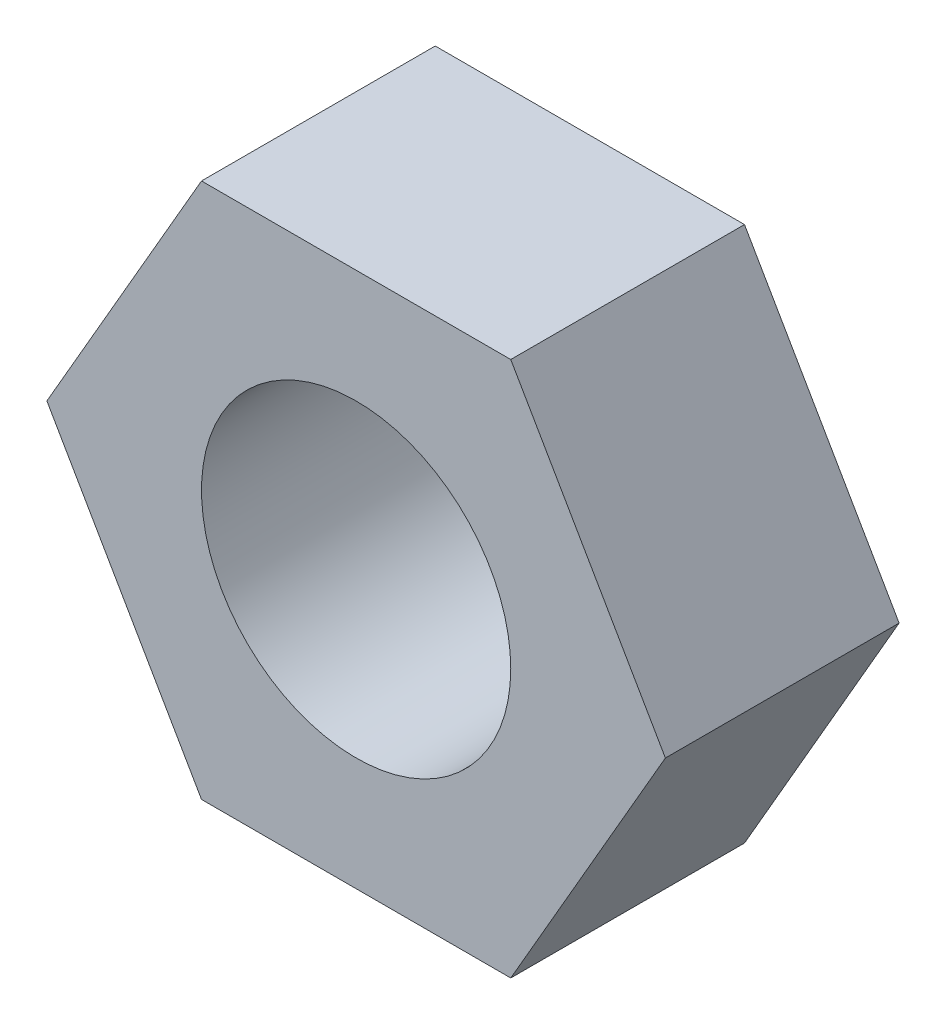
from build123d import *

# Parameters (mm, degrees)
SKETCH_1_R               = 1.58771324
EXTRUDE_M3_5_5_2_4_DEPTH = 2.4


with BuildPart() as part:
    # 草图1 → M3螺母_对边5.5_厚2.4_牙型简化 (new body)
    with BuildSketch(Plane.XY):
        Polygon((3.175426481, 0), (1.58771324, 2.75), (-1.58771324, 2.75), (-3.175426481, 0), (-1.58771324, -2.75), (1.58771324, -2.75), align=None)
        Circle(SKETCH_1_R, mode=Mode.SUBTRACT)
    extrude(amount=EXTRUDE_M3_5_5_2_4_DEPTH)


solid = part.part
